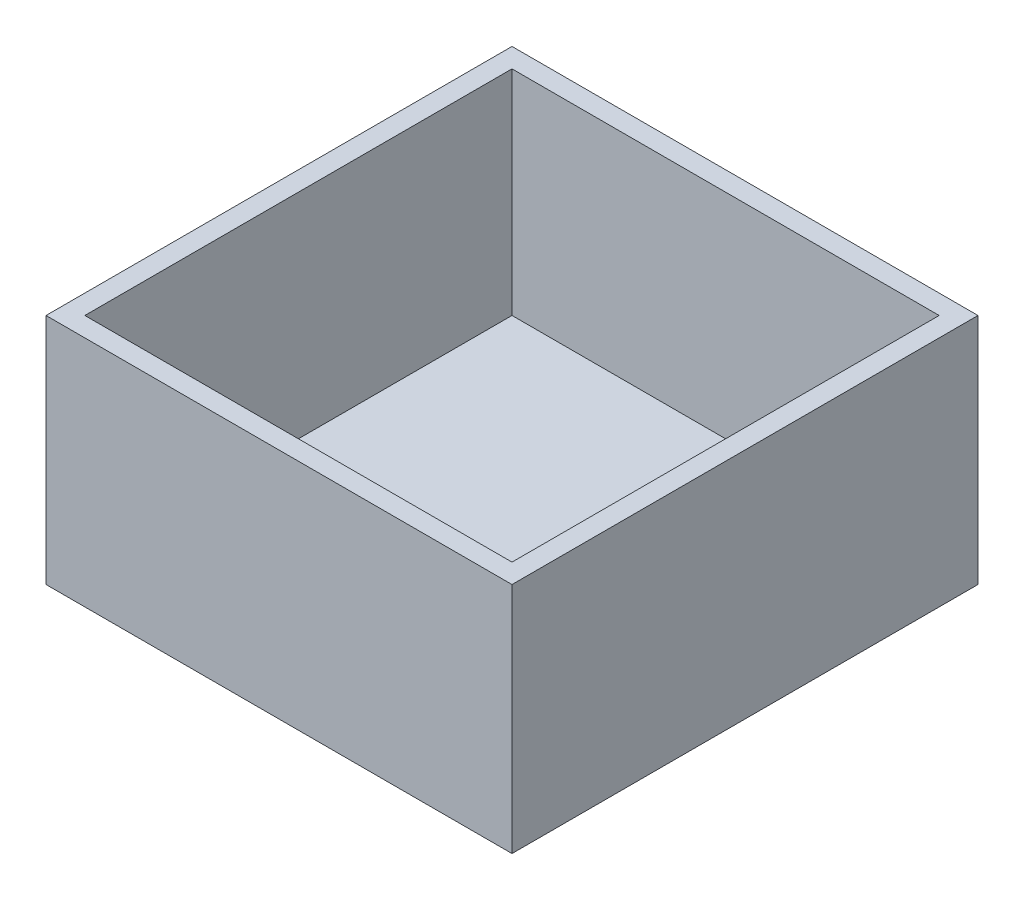
from build123d import *

# Parameters (mm, degrees)
SKETCH1_W           = 120
SKETCH1_H           = 120
BOSS_EXTRUDE1_DEPTH = 5
SKETCH2_W           = 120
SKETCH2_H           = 120
SKETCH2_W_2         = 110
SKETCH2_H_2         = 110
BOSS_EXTRUDE2_DEPTH = 55


with BuildPart() as part:
    # Sketch1 → Boss-Extrude1 (new body)
    with BuildSketch(Plane(origin=(0, 0, 0), x_dir=(1, 0, 0), z_dir=(0, 1, 0))):
        Rectangle(SKETCH1_W, SKETCH1_H)
    extrude(amount=BOSS_EXTRUDE1_DEPTH)

    # Sketch2 → Boss-Extrude2 (add)
    with BuildSketch(Plane(origin=(0, 5, 0), x_dir=(1, 0, 0), z_dir=(0, 1, 0))):
        Rectangle(SKETCH2_W, SKETCH2_H)
        Rectangle(SKETCH2_W_2, SKETCH2_H_2, mode=Mode.SUBTRACT)
    extrude(amount=BOSS_EXTRUDE2_DEPTH)


solid = part.part
